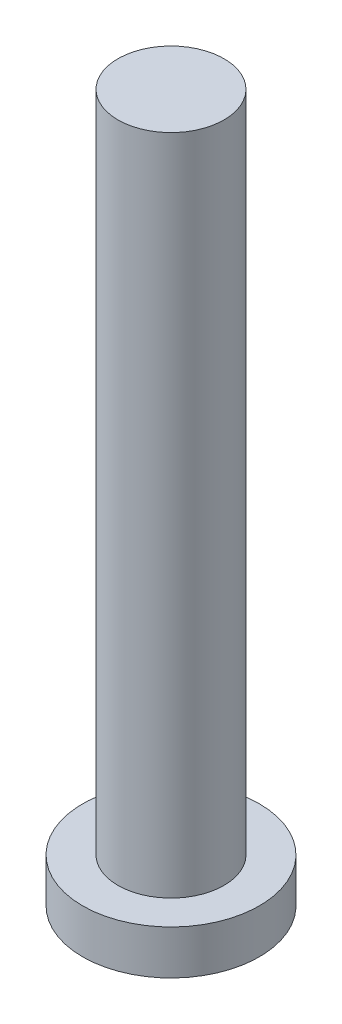
from build123d import *

# Parameters (mm, degrees)
SKETCH1_R           = 2
BOSS_EXTRUDE1_DEPTH = 1
SKETCH2_R           = 1.2
BOSS_EXTRUDE2_DEPTH = 15


with BuildPart() as part:
    # Sketch1 → Boss-Extrude1 (new body)
    with BuildSketch(Plane(origin=(0, 0, 0), x_dir=(1, 0, 0), z_dir=(0, 1, 0))):
        with Locations(Location((0, 0, 0), (0, 0, 270))):
            Circle(SKETCH1_R)
    extrude(amount=BOSS_EXTRUDE1_DEPTH)

    # Sketch2 → Boss-Extrude2 (add)
    with BuildSketch(Plane(origin=(0, 1, 0), x_dir=(1, 0, 0), z_dir=(0, 1, 0))):
        with Locations(Location((0, 0, 0), (0, 0, 270))):
            Circle(SKETCH2_R)
    extrude(amount=BOSS_EXTRUDE2_DEPTH)


solid = part.part
